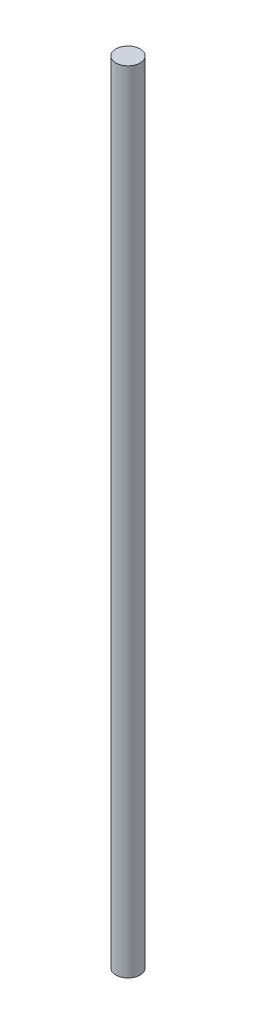
from build123d import *

# Parameters (mm, degrees)
SKETCH1_R           = 5
BOSS_EXTRUDE1_DEPTH = 325


with BuildPart() as part:
    # Sketch1 → Boss-Extrude1 (new body)
    with BuildSketch(Plane(origin=(0, 0, 0), x_dir=(1, 0, 0), z_dir=(0, 1, 0))):
        with Locations(Location((0, 0, 0), (0, 0, 270))):
            Circle(SKETCH1_R)
    extrude(amount=BOSS_EXTRUDE1_DEPTH)


solid = part.part
